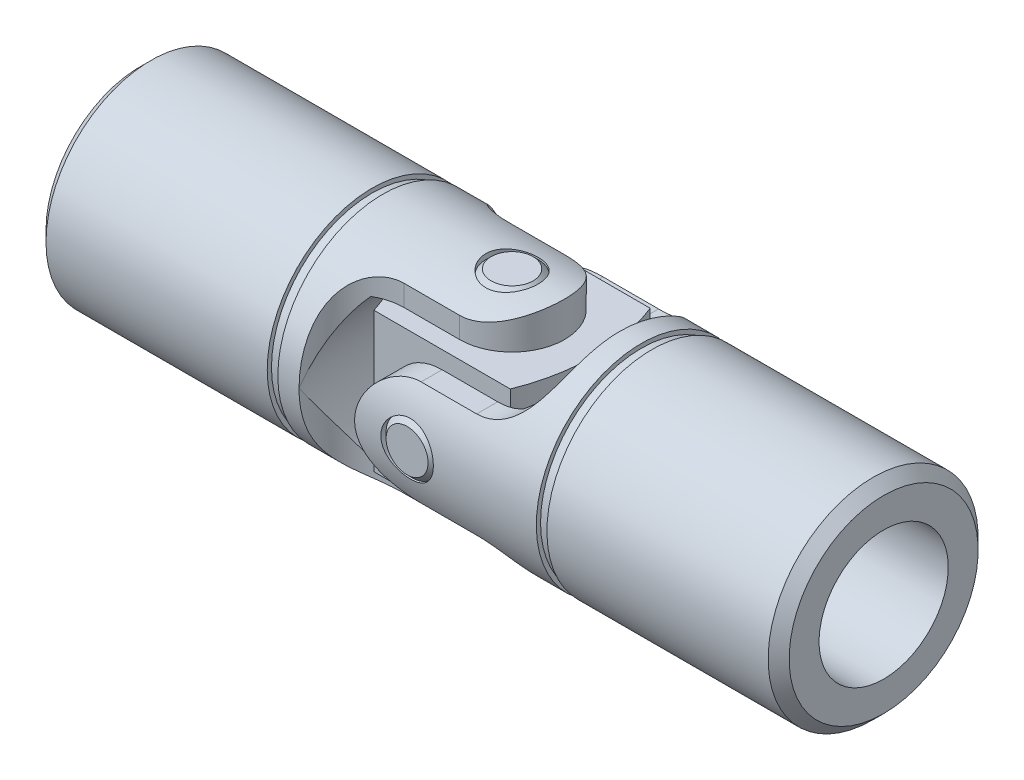
from build123d import *

# Parameters (mm, degrees)
CHAMFER1_SIZE               = 1.031875
EXTRUDE1_DEPTH              = 40.320679793
EXTRUDE1_DEPTH_BACK         = 40.320679793
EXTRUDE3_DEPTH              = 40.320679845
EXTRUDE3_DEPTH_BACK         = 40.320679845
SKETCH4_R                   = 6.35
EXTRUDE4_DEPTH              = 22.225
EXTRUDE6_DEPTH              = 40.320679845
EXTRUDE6_DEPTH_BACK         = 40.320679845
SKETCH6_R                   = 2.5796875
BODY_MOVE_COPY1_ANGLE       = 90
EXTRUDE10_REACH             = 41.321
SKETCH10_W                  = 16.0734375
SKETCH10_H                  = 13.744575
EXTRUDE10_DIRECTION_2_REACH = 41.321
CUT_EXTRUDE2_DEPTH          = 42.655384209
EXTRUDE13_DEPTH             = 40.320679845
EXTRUDE13_DEPTH_BACK        = 40.320679845
SKETCH13_R                  = 2.5796875
SKETCH14_R                  = 2.5796875
EXTRUDE14_DEPTH             = 10.31875
EXTRUDE15_DEPTH             = 40.320679845
EXTRUDE15_DEPTH_BACK        = 40.320679845
SKETCH15_R                  = 2.5796875
SKETCH16_R                  = 2.5796875
EXTRUDE16_DEPTH             = 10.31875
CHAMFER3_SIZE               = 0.5159375


with BuildPart() as part:
    # Sketch1 → Revolve1 (revolve)
    with BuildSketch(Plane(origin=(0, 0, 0), x_dir=(1, 0, 0), z_dir=(0, 1, 0)), mode=Mode.PRIVATE) as revolve1_sk:
        Polygon((-36.5125, 10.31875), (-13.741796875, 10.31875), (-13.741796875, 9.90203125), (-12.7, 9.90203125), (-12.7, 10.31875), (5.159375, 10.31875), (5.159375, 0), (-36.5125, 0), align=None)
    revolve(revolve1_sk.sketch.rotate(Axis((-36.5125, 0, 0), (1, 0, 0)), 180), axis=Axis((-36.5125, 0, 0), (1, 0, 0)))

    # Chamfer1
    chamfer1_edges = [part.edges().sort_by_distance(p)[0] for p in [
        (-36.5125, 0, -10.31875),
    ]]
    chamfer(chamfer1_edges, length=CHAMFER1_SIZE)

    # Sketch2 → Extrude1 (cut, two sides: drawn at the far end of the back side and taken through both)
    with BuildSketch(Plane(origin=(0, 0, 0), x_dir=(1, 0, 0), z_dir=(0, 1, 0)).offset(-EXTRUDE1_DEPTH_BACK)):
        with BuildLine():
            Line((-10.61640625, 10.31875), (10.31875, 10.31875))
            Line((10.31875, 10.31875), (10.31875, -10.31875))
            Line((10.31875, -10.31875), (-10.61640625, -10.31875))
            ThreePointArc((-10.61640625, -10.31875), (-9.105260299, -6.670520951), (-5.45703125, -5.159375))
            Line((-5.45703125, -5.159375), (0, -5.159375))
            ThreePointArc((0, -5.159375), (5.159375, 0), (0, 5.159375))
            Line((0, 5.159375), (-5.45703125, 5.159375))
            ThreePointArc((-5.45703125, 5.159375), (-9.105260299, 6.670520951), (-10.61640625, 10.31875))
        make_face()
    extrude(amount=EXTRUDE1_DEPTH + EXTRUDE1_DEPTH_BACK, mode=Mode.SUBTRACT)

    # Sketch3 → Extrude3 (cut, two sides: drawn at the far end of the back side and taken through both)
    with BuildSketch(Plane.XY.offset(-EXTRUDE3_DEPTH_BACK)):
        with BuildLine():
            Line((-8.03671875, 6.8722875), (10.31875, 6.8722875))
            Line((10.31875, 6.8722875), (10.31875, -6.8722875))
            Line((10.31875, -6.8722875), (-8.03671875, -6.8722875))
            ThreePointArc((-8.03671875, -6.8722875), (-10.61640625, 0), (-8.03671875, 6.8722875))
        make_face()
    extrude(amount=EXTRUDE3_DEPTH + EXTRUDE3_DEPTH_BACK, mode=Mode.SUBTRACT)

    # Sketch4 → Extrude4 (cut)
    with BuildSketch(Plane.ZY.offset(36.5125)):
        Circle(SKETCH4_R)
    extrude(amount=-EXTRUDE4_DEPTH, mode=Mode.SUBTRACT)

    # Extrude5 cone 1 section (through the dimple's axis) → Extrude5 (revolve, cut)
    with BuildSketch(Plane(origin=(-14.2875, 0, 0), x_dir=(0, 0, 1), z_dir=(0, 1, 0))):
        Polygon((0, 0), (6.35, 0), (0, 6.35), align=None)
    revolve(axis=Axis((-14.2875, 0, 0), (1, 0, 0)), mode=Mode.SUBTRACT)

    # Sketch6 → Extrude6 (cut, two sides: drawn at the far end of the back side and taken through both)
    with BuildSketch(Plane(origin=(0, 0, 0), x_dir=(1, 0, 0), z_dir=(0, 1, 0)).offset(-EXTRUDE6_DEPTH_BACK)):
        with Locations(Location((0, 0, 0), (0, 0, 270))):
            Circle(SKETCH6_R)
    extrude(amount=EXTRUDE6_DEPTH + EXTRUDE6_DEPTH_BACK, mode=Mode.SUBTRACT)


with BuildPart() as body_2:
    # Mirror1: mirrored copy
    add(part.part.mirror(Plane(origin=(0, 0, 0), x_dir=(0, 0, 1), z_dir=(1, 0, 0))))


with BuildPart() as body_2_1:
    # Body-Move/Copy1: moved
    add(body_2.part.rotate(Axis((0, 0, 0), (1, 0, 0)), BODY_MOVE_COPY1_ANGLE))


with BuildPart() as body_3:

    # Extrude10: up to this face of the body (flat: up to its plane)
    extrude10_end = Plane(body_2_1.part.faces().sort_by_distance((6.838023031, -5.164818509, -6.8722875))[0])
    # Sketch10 → Extrude10 (new, up to the picked face)
    with BuildSketch(Plane.XY, mode=Mode.PRIVATE) as extrude10_sk1:
        Rectangle(SKETCH10_W, SKETCH10_H)
    extrude10_tool1 = split(extrude(extrude10_sk1.sketch, amount=-EXTRUDE10_REACH, mode=Mode.PRIVATE), bisect_by=extrude10_end, keep=Keep.BOTH, mode=Mode.PRIVATE)
    add(extrude10_tool1.solids().sort_by(Axis((0, 0, 0), (0, 0, -1)))[0])


    # Extrude10 direction 2: up to this face of the body (flat: up to its plane)
    extrude10_direction_2_end = Plane(body_2_1.part.faces().sort_by_distance((7.860351242, 0, 6.8722875))[0])
    # Sketch10 → Extrude10 direction 2 (add, up to the picked face)
    with BuildSketch(Plane.XY, mode=Mode.PRIVATE) as extrude10_direction_2_sk1:
        Rectangle(SKETCH10_W, SKETCH10_H)
    extrude10_direction_2_tool1 = split(extrude(extrude10_direction_2_sk1.sketch, amount=EXTRUDE10_DIRECTION_2_REACH, mode=Mode.PRIVATE), bisect_by=extrude10_direction_2_end, keep=Keep.BOTH, mode=Mode.PRIVATE)
    add(extrude10_direction_2_tool1.solids().sort_by(Axis((0, 0, 0), (0, 0, 1)))[0])

    # Sketch20 → Cut-Extrude2 (cut, through all)
    with BuildSketch(Plane(origin=(0, 6.8722875, 0), x_dir=(1, 0, 0), z_dir=(0, 1, 0))):
        with BuildLine():
            Line((9.05271875, -7.8882875), (9.05271875, 7.8882875))
            Line((9.05271875, 7.8882875), (6.697265625, 7.8882875))
            Line((6.697265625, 7.8882875), (6.697265625, 6.8722875))
            ThreePointArc((6.697265625, 6.8722875), (8.03671875, 0), (6.697265625, -6.8722875))
            Line((6.697265625, -6.8722875), (6.697265625, -7.8882875))
            Line((6.697265625, -7.8882875), (9.05271875, -7.8882875))
        make_face()
        with BuildLine():
            Line((-9.05271875, 7.8882875), (-9.05271875, -7.8882875))
            Line((-9.05271875, -7.8882875), (-6.697265625, -7.8882875))
            Line((-6.697265625, -7.8882875), (-6.697265625, -6.8722875))
            ThreePointArc((-6.697265625, -6.8722875), (-8.03671875, 0), (-6.697265625, 6.8722875))
            Line((-6.697265625, 6.8722875), (-6.697265625, 7.8882875))
            Line((-6.697265625, 7.8882875), (-9.05271875, 7.8882875))
        make_face()
    extrude(amount=-CUT_EXTRUDE2_DEPTH, mode=Mode.SUBTRACT)

    # Sketch13 → Extrude13 (cut, two sides: drawn at the far end of the back side and taken through both)
    with BuildSketch(Plane(origin=(0, 0, 0), x_dir=(1, 0, 0), z_dir=(0, 1, 0)).offset(-EXTRUDE13_DEPTH_BACK)):
        with Locations(Location((0, 0, 0), (0, 0, 270))):
            Circle(SKETCH13_R)
    extrude(amount=EXTRUDE13_DEPTH + EXTRUDE13_DEPTH_BACK, mode=Mode.SUBTRACT)

    # Sketch15 → Extrude15 (cut, two sides: drawn at the far end of the back side and taken through both)
    with BuildSketch(Plane.XY.offset(-EXTRUDE15_DEPTH_BACK)):
        Circle(SKETCH15_R)
    extrude(amount=EXTRUDE15_DEPTH + EXTRUDE15_DEPTH_BACK, mode=Mode.SUBTRACT)


with BuildPart() as body_4:
    # Sketch14 → Extrude14 (new, symmetric)
    with BuildSketch(Plane(origin=(0, 0, 0), x_dir=(1, 0, 0), z_dir=(0, 1, 0))):
        with Locations(Location((0, 0, 0), (0, 0, 270))):
            Circle(SKETCH14_R)
    extrude(amount=EXTRUDE14_DEPTH, both=True)

    # Sketch16 → Extrude16 (add, symmetric)
    with BuildSketch(Plane.XY):
        Circle(SKETCH16_R)
    extrude(amount=EXTRUDE16_DEPTH, both=True)

    # Chamfer3
    chamfer3_edges = [body_4.edges().sort_by_distance(p)[0] for p in [
        (0, -10.31875, -2.5796875),
        (0, 10.31875, -2.5796875),
        (-2.5796875, 0, -10.31875),
        (-2.5796875, 0, 10.31875),
    ]]
    chamfer(chamfer3_edges, length=CHAMFER3_SIZE)


solid = Compound([part.part, body_2_1.part, body_3.part, body_4.part])
